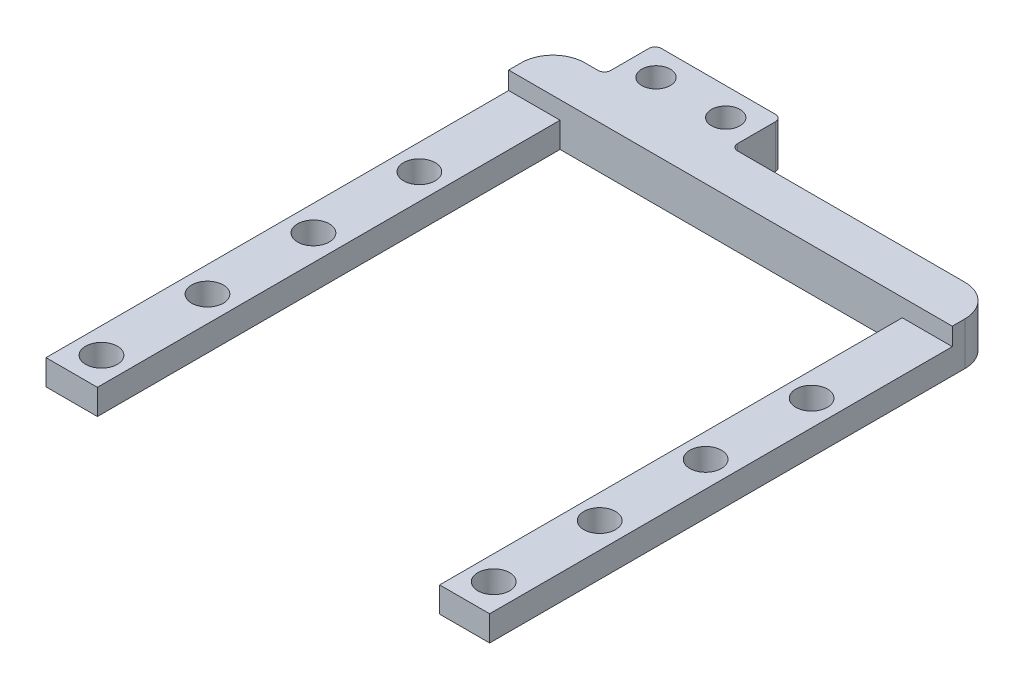
from build123d import *

# Parameters (mm, degrees)
SKETCH1_W               = 70
SKETCH1_H               = 80
BOSS_EXTRUDE1_DEPTH     = 6.8
SKETCH2_W               = 54
SKETCH2_H               = 73
CUT_EXTRUDE1_DEPTH      = 107.518730747
SKETCH3_R               = 2.5
CUT_EXTRUDE2_DEPTH      = 107.518730747
LPATTERN1_COUNT         = 4
LPATTERN1_PITCH         = 16.72
MIRROR1_COPY_1_SKETCH_R = 2.5
MIRROR1_COPY_1_DEPTH    = 107.518730747
MIRROR1_COPY_2_SKETCH_R = 2.5
MIRROR1_COPY_2_DEPTH    = 107.518730747
MIRROR1_COPY_3_SKETCH_R = 2.5
MIRROR1_COPY_3_DEPTH    = 107.518730747
SKETCH5_W               = 8.11
SKETCH5_H               = 73
CUT_EXTRUDE3_DEPTH      = 2.8
SKETCH4_W               = 20
SKETCH4_H               = 8
BOSS_EXTRUDE2_DEPTH     = 6.8
SKETCH7_R               = 2.25
CUT_EXTRUDE4_DEPTH      = 6.8
FILLET1_R               = 1
FILLET2_R               = 1
FILLET3_R               = 5


with BuildPart() as part:
    # Sketch1 → Boss-Extrude1 (new body)
    with BuildSketch(Plane(origin=(0, 0, 0), x_dir=(1, 0, 0), z_dir=(0, 1, 0))):
        with Locations((35, -40)):
            Rectangle(SKETCH1_W, SKETCH1_H)
    extrude(amount=BOSS_EXTRUDE1_DEPTH)

    # Sketch2 → Cut-Extrude1 (cut, through all)
    with BuildSketch(Plane(origin=(0, 6.8, 0), x_dir=(1, 0, 0), z_dir=(0, 1, 0))):
        with Locations((35.11, -43.5)):
            Rectangle(SKETCH2_W, SKETCH2_H)
    extrude(amount=-CUT_EXTRUDE1_DEPTH, mode=Mode.SUBTRACT)

    # Sketch3 → Cut-Extrude2 (cut, through all)
    with BuildSketch(Plane(origin=(0, 6.8, 0), x_dir=(1, 0, 0), z_dir=(0, 1, 0))):
        with Locations(Location((4.055, -75.3, 0), (0, 0, 270))):
            Circle(SKETCH3_R)
    cut_extrude2 = extrude(amount=-CUT_EXTRUDE2_DEPTH, mode=Mode.SUBTRACT)

    # LPattern1: Cut-Extrude2 ×4
    with Locations(*[(0, 0, -i * LPATTERN1_PITCH) for i in range(1, LPATTERN1_COUNT)]):
        add(cut_extrude2, mode=Mode.SUBTRACT)

    # Mirror1: Cut-Extrude2 across plane
    add(cut_extrude2.mirror(Plane(origin=(35, 0, 0), x_dir=(0, 0, 1), z_dir=(1, 0, 0))), mode=Mode.SUBTRACT)

    # Mirror1 copy 1 sketch → Mirror1 copy 1 (cut, through all)
    with BuildSketch(Plane(origin=(70, 6.8, -16.72), x_dir=(-1, 0, 0), z_dir=(0, 1, 0))):
        with Locations((4.055, 75.3)):
            Circle(MIRROR1_COPY_1_SKETCH_R)
    extrude(amount=-MIRROR1_COPY_1_DEPTH, mode=Mode.SUBTRACT)

    # Mirror1 copy 2 sketch → Mirror1 copy 2 (cut, through all)
    with BuildSketch(Plane(origin=(70, 6.8, -33.44), x_dir=(-1, 0, 0), z_dir=(0, 1, 0))):
        with Locations((4.055, 75.3)):
            Circle(MIRROR1_COPY_2_SKETCH_R)
    extrude(amount=-MIRROR1_COPY_2_DEPTH, mode=Mode.SUBTRACT)

    # Mirror1 copy 3 sketch → Mirror1 copy 3 (cut, through all)
    with BuildSketch(Plane(origin=(70, 6.8, -50.16), x_dir=(-1, 0, 0), z_dir=(0, 1, 0))):
        with Locations((4.055, 75.3)):
            Circle(MIRROR1_COPY_3_SKETCH_R)
    extrude(amount=-MIRROR1_COPY_3_DEPTH, mode=Mode.SUBTRACT)

    # Sketch5 → Cut-Extrude3 (cut)
    with BuildSketch(Plane(origin=(0, 6.8, 0), x_dir=(1, 0, 0), z_dir=(0, 1, 0))):
        with Locations((4.055, -43.5)):
            Rectangle(SKETCH5_W, SKETCH5_H)
    cut_extrude3 = extrude(amount=-CUT_EXTRUDE3_DEPTH, mode=Mode.SUBTRACT)

    # Mirror2: Cut-Extrude3 across plane
    add(cut_extrude3.mirror(Plane(origin=(35, 0, 0), x_dir=(0, 0, 1), z_dir=(1, 0, 0))), mode=Mode.SUBTRACT)

    # Sketch4 → Boss-Extrude2 (add)
    with BuildSketch(Plane(origin=(0, 6.8, 0), x_dir=(1, 0, 0), z_dir=(0, 1, 0))):
        with Locations((18.11, 4)):
            Rectangle(SKETCH4_W, SKETCH4_H)
    extrude(amount=-BOSS_EXTRUDE2_DEPTH)

    # Sketch7 → Cut-Extrude4 (cut)
    with BuildSketch(Plane(origin=(0, 6.8, 0), x_dir=(1, 0, 0), z_dir=(0, 1, 0))):
        with Locations(Location((12.625606255, 3.625550083, 0), (0, 0, 270))):
            Circle(SKETCH7_R)
        with Locations(Location((23.625606255, 3.625550083, 0), (0, 0, 270))):
            Circle(SKETCH7_R)
    extrude(amount=-CUT_EXTRUDE4_DEPTH, mode=Mode.SUBTRACT)

    # Fillet1
    fillet1_edges = [part.edges().sort_by_distance(p)[0] for p in [
        (8.11, 3.4, 0),
    ]]
    fillet(fillet1_edges, radius=FILLET1_R)

    # Fillet2
    fillet2_edges = [part.edges().sort_by_distance(p)[0] for p in [
        (8.11, 3.4, -8),
        (28.11, 3.4, -8),
        (28.11, 3.4, 0),
    ]]
    fillet(fillet2_edges, radius=FILLET2_R)

    # Fillet3
    fillet3_edges = [part.edges().sort_by_distance(p)[0] for p in [
        (0, 3.4, 0),
        (70, 3.4, 0),
    ]]
    fillet(fillet3_edges, radius=FILLET3_R)


solid = part.part
